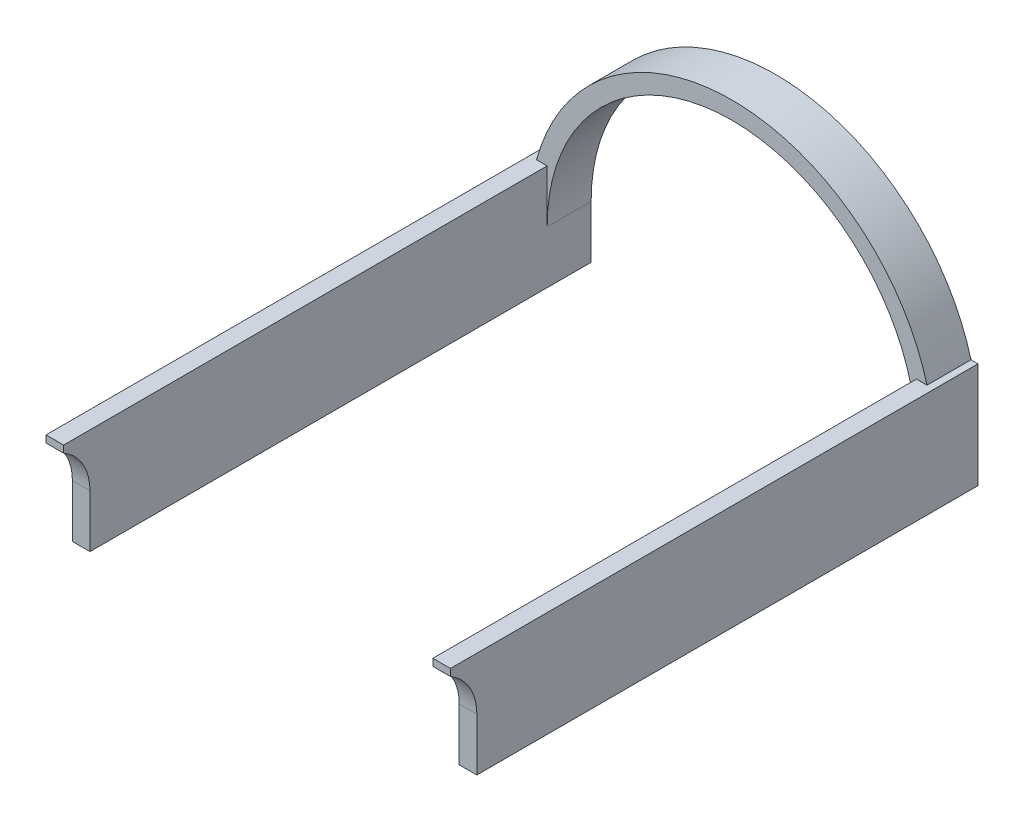
from build123d import *

# Parameters (mm, degrees)
EXTRUDE_1_DEPTH     = 10
SKETCH_3_W          = 4
SKETCH_3_H          = 24
EXTRUDE_2_DEPTH     = 120
CUT_EXTRUDE_1_DEPTH = 120


with BuildPart() as part:
    # 草图2 → 凸台-拉伸1 (new body)
    with BuildSketch(Plane.XY):
        with BuildLine():
            Line((-46, 0), (-42, 0))
            ThreePointArc((-42, 0), (0, 42), (42, 0))
            Line((42, 0), (46, 0))
            ThreePointArc((46, 0), (0, 46), (-46, 0))
        make_face()
    extrude(amount=EXTRUDE_1_DEPTH)

    # 草图3 → 凸台-拉伸2 (add)
    with BuildSketch(Plane(origin=(0, 0, 0), x_dir=(-1, 0, 0), z_dir=(0, 0, -1))):
        with Locations((-44, 0)):
            Rectangle(SKETCH_3_W, SKETCH_3_H)
        with Locations((44, 0)):
            Rectangle(SKETCH_3_W, SKETCH_3_H)
    extrude(amount=-EXTRUDE_2_DEPTH)

    # 草图4 → 切除-拉伸1 (cut)
    with BuildSketch(Plane.ZY.offset(46)):
        with BuildLine():
            Line((114, 0), (114, -12))
            Line((114, -12), (126, -12))
            ThreePointArc((126, -12), (134.485281374, 8.485281374), (114, 0))
        make_face()
    extrude(amount=-CUT_EXTRUDE_1_DEPTH, mode=Mode.SUBTRACT)


solid = part.part
